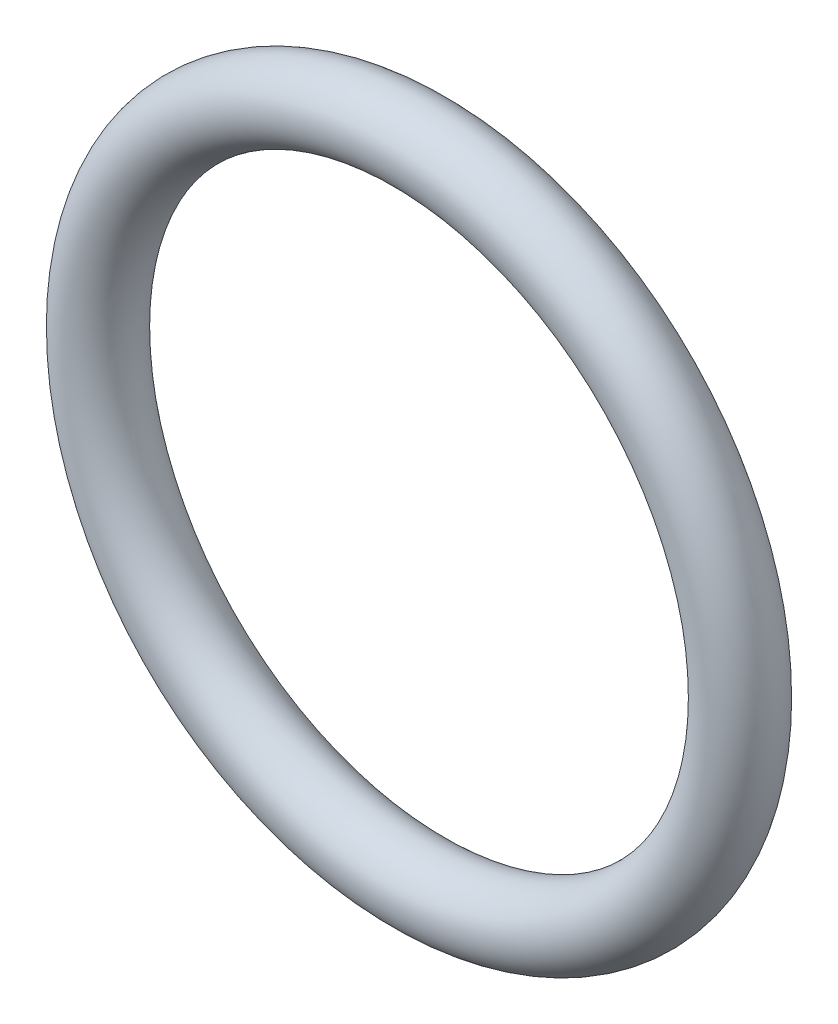
from build123d import *

# Parameters (mm, degrees)
ESQUISSE1_R = 1.65


with BuildPart() as part:
    # Balayage1: sweep along a path in Esquisse2
    with BuildLine(Plane.XY) as balayage1_path:
        CenterArc((0, 14.5), 14.5, 0, 360)
    # Esquisse1 → Balayage1 (sweep)
    with BuildSketch(Plane(origin=(0, 0, 0), x_dir=(0, 0, -1), z_dir=(1, 0, 0))):
        Circle(ESQUISSE1_R)
    sweep(path=balayage1_path.line)


solid = part.part
